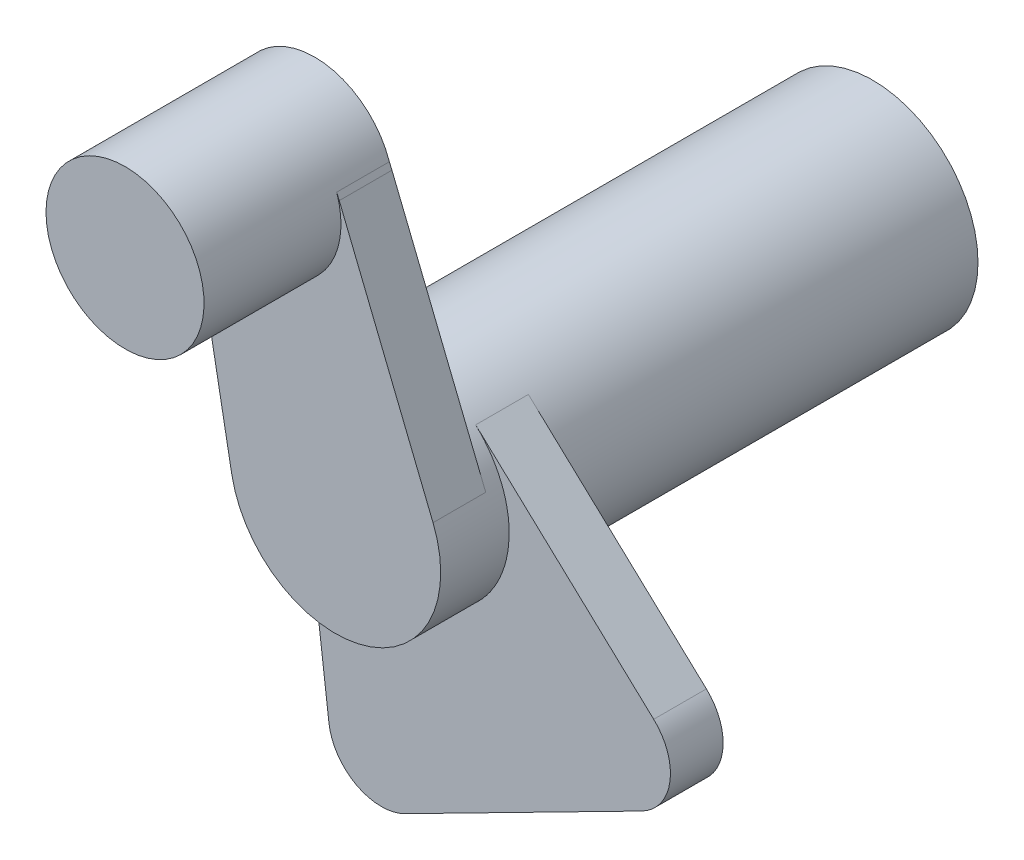
from build123d import *

# Parameters (mm, degrees)
SKETCH1_R           = 20
BOSS_EXTRUDE1_DEPTH = 102
BOSS_EXTRUDE2_START = -10
BOSS_EXTRUDE2_DEPTH = 10
BOSS_EXTRUDE3_START = -10
SKETCH3_R           = 20
BOSS_EXTRUDE3_DEPTH = 10
SKETCH4_R           = 15
BOSS_EXTRUDE4_DEPTH = 36


with BuildPart() as part:
    # Sketch1 → Boss-Extrude1 (new body)
    with BuildSketch(Plane.XY):
        Circle(SKETCH1_R)
    extrude(amount=BOSS_EXTRUDE1_DEPTH)

    # Sketch3 → Boss-Extrude3 (add)
    with BuildSketch(Plane.XY.offset(102).offset(BOSS_EXTRUDE3_START)):
        with BuildLine():
            ThreePointArc((-19.666174765, -3.638896824), (-5.594629402, 19.20156561), (18.542984562, 7.49384571))
            Line((18.542984562, 7.49384571), (0.739309321, 51.54776514))
            Line((0.739309321, 51.54776514), (0.253016385, 52.694397104))
            ThreePointArc((0.253016385, 52.694397104), (-17.744840944, 62.329365212), (-28.683102916, 45.092488931))
            Line((-28.683102916, 45.092488931), (-19.666174765, -3.638896824))
        make_face()
        with Locations(Location((0, 0, 0), (0, 0, 190.483061842))):
            Circle(SKETCH3_R)
    extrude(amount=BOSS_EXTRUDE3_DEPTH)

    # Sketch4 → Boss-Extrude4 (add)
    with BuildSketch(Plane(origin=(0, 0, 92), x_dir=(-1, 0, 0), z_dir=(0, 0, -1))):
        with Locations(Location((13.933471842, 47.821661549, 0), (0, 0, 161.043570809))):
            Circle(SKETCH4_R)
    extrude(amount=-BOSS_EXTRUDE4_DEPTH)


with BuildPart() as body_2:
    # Sketch2 → Boss-Extrude2 (new body)
    with BuildSketch(Plane.XY.offset(89).offset(BOSS_EXTRUDE2_START)):
        with BuildLine():
            Line((-19.850697676, -2.439221552), (-14.21526494, -48.301095563))
            ThreePointArc((-14.21526494, -48.301095563), (-8.983815658, -55.911394581), (0.250812376, -55.991130397))
            Line((0.250812376, -55.991130397), (45.15647241, -33.105325697))
            ThreePointArc((45.15647241, -33.105325697), (50.518553205, -25.586495849), (47.435051559, -16.881512775))
            Line((47.435051559, -16.881512775), (13.638615256, 14.628334625))
            ThreePointArc((13.638615256, 14.628334625), (18.34083293, 7.97582895), (20, 0))
            ThreePointArc((20, 0), (1.221893302, -19.962639524), (-19.850697676, -2.439221552))
        make_face()
    extrude(amount=BOSS_EXTRUDE2_DEPTH)


solid = Compound([part.part, body_2.part])
